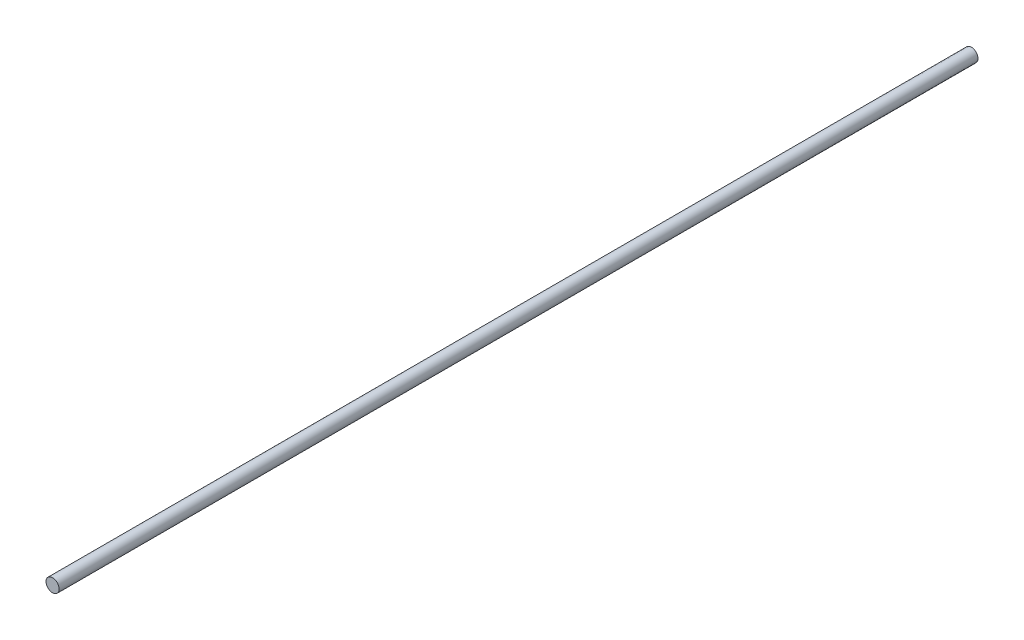
from build123d import *

# Parameters (mm, degrees)
SKETCH2_R           = 5
BOSS_EXTRUDE1_DEPTH = 700


with BuildPart() as part:
    # Sketch2 → Boss-Extrude1 (new body)
    with BuildSketch(Plane.XY):
        Circle(SKETCH2_R)
    extrude(amount=BOSS_EXTRUDE1_DEPTH)


solid = part.part
